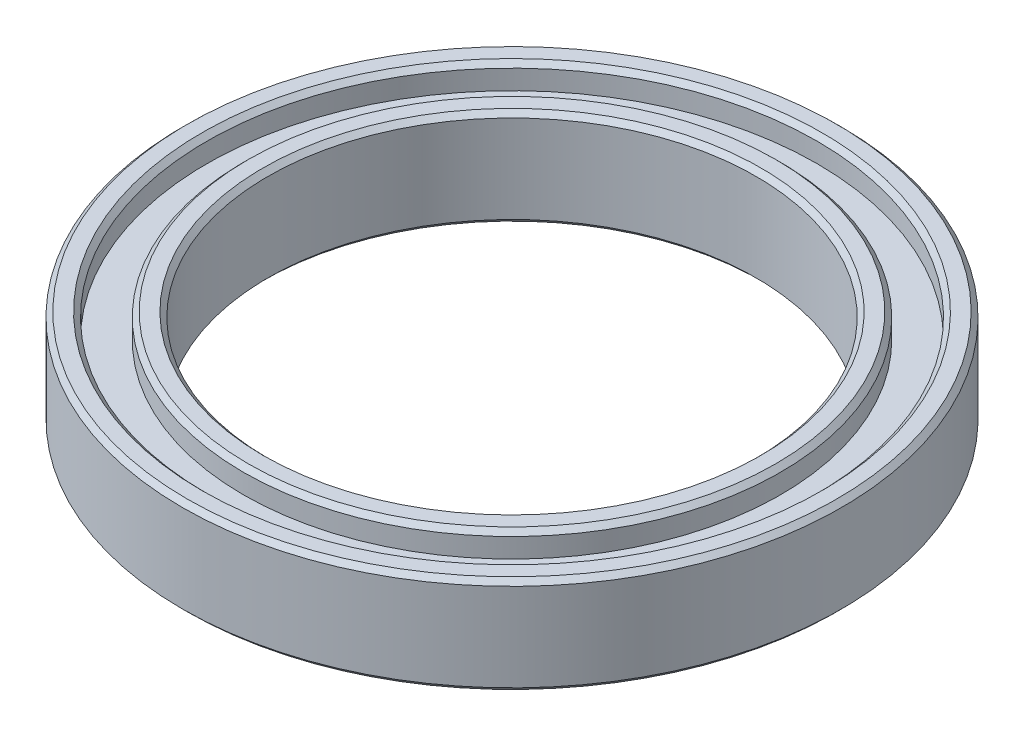
from build123d import *

# Parameters (mm, degrees)
SKETCH1_R           = 13.5
SKETCH1_R_2         = 10
BOSS_EXTRUDE1_DEPTH = 4
SKETCH2_R           = 12.5
SKETCH2_R_2         = 11
CUT_EXTRUDE1_DEPTH  = 1
CUT_EXTRUDE2_START  = -1
SKETCH3_R           = 12.5
SKETCH3_R_2         = 11
CUT_EXTRUDE2_DEPTH  = 1
CHAMFER1_SIZE       = 0.2


with BuildPart() as part:
    # Sketch1 → Boss-Extrude1 (new body)
    with BuildSketch(Plane(origin=(0, 0, 0), x_dir=(1, 0, 0), z_dir=(0, 1, 0))):
        with Locations(Location((0, 0, 0), (0, 0, 270))):
            Circle(SKETCH1_R)
        with Locations(Location((0, 0, 0), (0, 0, 270))):
            Circle(SKETCH1_R_2, mode=Mode.SUBTRACT)
    extrude(amount=BOSS_EXTRUDE1_DEPTH)

    # Sketch2 → Cut-Extrude1 (cut)
    with BuildSketch(Plane(origin=(0, 4, 0), x_dir=(1, 0, 0), z_dir=(0, 1, 0))):
        with Locations(Location((0, 0, 0), (0, 0, 270))):
            Circle(SKETCH2_R)
        with Locations(Location((0, 0, 0), (0, 0, 270))):
            Circle(SKETCH2_R_2, mode=Mode.SUBTRACT)
    extrude(amount=-CUT_EXTRUDE1_DEPTH, mode=Mode.SUBTRACT)

    # Sketch3 → Cut-Extrude2 (cut)
    with BuildSketch(Plane.XZ.offset(CUT_EXTRUDE2_START)):
        with Locations(Location((0, 0, 0), (0, 0, 90))):
            Circle(SKETCH3_R)
        with Locations(Location((0, 0, 0), (0, 0, 90))):
            Circle(SKETCH3_R_2, mode=Mode.SUBTRACT)
    extrude(amount=CUT_EXTRUDE2_DEPTH, mode=Mode.SUBTRACT)

    # Chamfer1
    chamfer1_edges = [part.edges().sort_by_distance(p)[0] for p in [
        (0, 4, -12.5),
        (0, 4, -11),
        (0, 0, -13.5),
        (0, 0, -12.5),
        (0, 0, -11),
        (0, 4, -13.5),
        (0, 0, -10),
        (0, 4, -10),
    ]]
    chamfer(chamfer1_edges, length=CHAMFER1_SIZE)


solid = part.part
